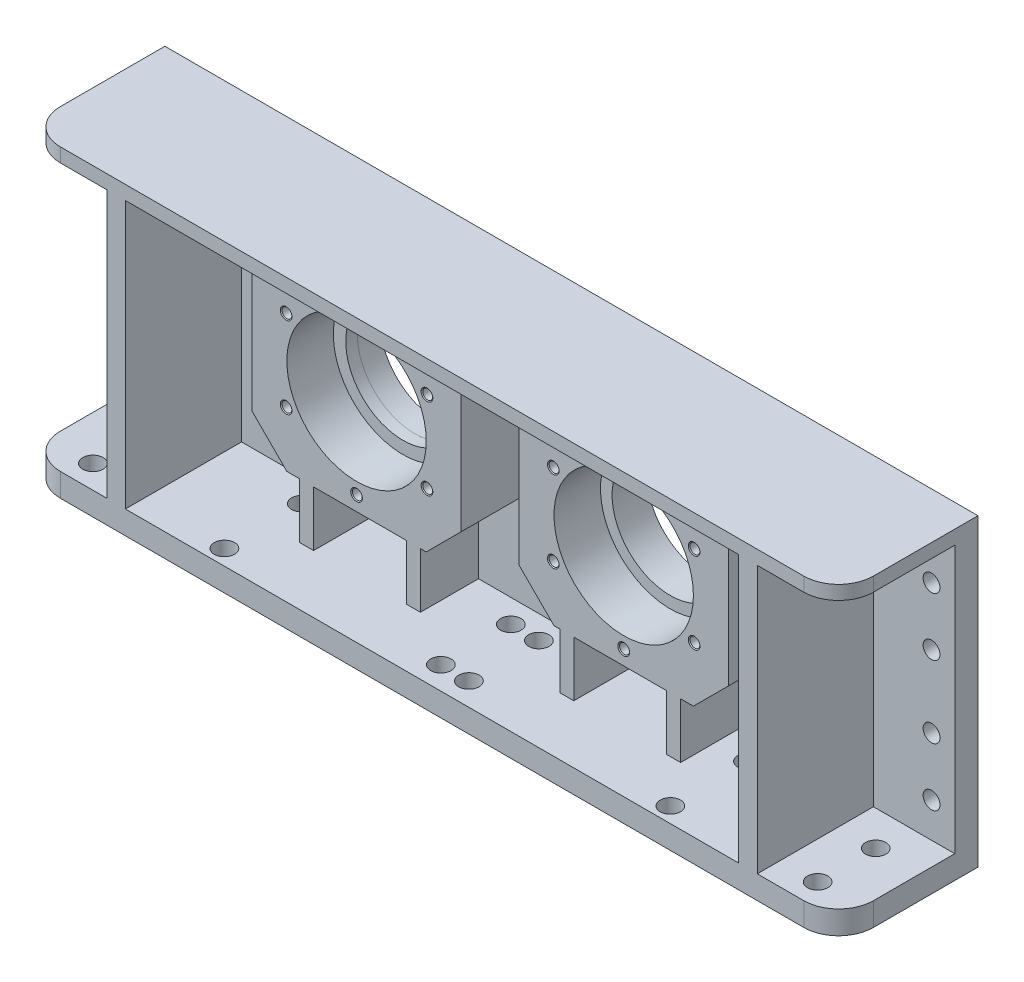
from build123d import *

# Parameters (mm, degrees)
SKETCH1_W           = 700
SKETCH1_H           = 120
BOSS_EXTRUDE1_DEPTH = 20
SKETCH2_W           = 700
SKETCH2_H           = 242
BOSS_EXTRUDE2_DEPTH = 20
BOSS_EXTRUDE3_DEPTH = 100
SKETCH4_R           = 50
CUT_EXTRUDE1_DEPTH  = 30
BOSS_EXTRUDE4_START = 50
SKETCH5_W           = 180
SKETCH5_H           = 165
SKETCH5_R           = 49.3285836
SKETCH5_R_2         = 50
BOSS_EXTRUDE4_DEPTH = 50
SKETCH7_R           = 60
CUT_EXTRUDE2_DEPTH  = 40
FILLET1_R           = 30
CHAMFER1_SIZE       = 30
SKETCH8_W           = 12
SKETCH8_H           = 50
BOSS_EXTRUDE5_DEPTH = 47.5
CIRPATTERN1_COUNT   = 6
SKETCH11_R          = 7.25
CUT_EXTRUDE3_DEPTH  = 40
SKETCH12_R          = 8.75
CUT_EXTRUDE4_DEPTH  = 40


with BuildPart() as part:
    # Sketch1 → Boss-Extrude1 (new body)
    with BuildSketch(Plane(origin=(0, 0, 0), x_dir=(1, 0, 0), z_dir=(0, 1, 0))):
        with Locations((0, -60)):
            Rectangle(SKETCH1_W, SKETCH1_H)
    extrude(amount=BOSS_EXTRUDE1_DEPTH)

    # Sketch2 → Boss-Extrude2 (add)
    with BuildSketch(Plane.XY):
        with Locations((0, 141)):
            Rectangle(SKETCH2_W, SKETCH2_H)
    extrude(amount=BOSS_EXTRUDE2_DEPTH)

    # Sketch3 → Boss-Extrude3 (add)
    with BuildSketch(Plane.XY.offset(20)):
        Polygon((350, 262), (-350, 262), (-350, 250), (-280, 250), (-280, 20), (-264, 20), (-264, 250), (264, 250), (264, 20), (280, 20), (280, 250), (350, 250), align=None)
    extrude(amount=BOSS_EXTRUDE3_DEPTH)

    # Sketch4 → Cut-Extrude1 (cut)
    with BuildSketch(Plane.XY.offset(20)):
        with Locations((-115, 150)):
            Circle(SKETCH4_R)
        with Locations((115, 150)):
            Circle(SKETCH4_R)
    extrude(amount=-CUT_EXTRUDE1_DEPTH, mode=Mode.SUBTRACT)

    # Sketch5 → Boss-Extrude4 (add)
    # profile 1 of 2: a face of its own
    with BuildSketch(Plane.XY.offset(20).offset(BOSS_EXTRUDE4_START)):
        with Locations((-115, 150)):
            Rectangle(SKETCH5_W, SKETCH5_H)
        with Locations((-115, 150)):
            Circle(SKETCH5_R, mode=Mode.SUBTRACT)
    # profile 2 of 2: a face of its own
    with BuildSketch(Plane.XY.offset(20).offset(BOSS_EXTRUDE4_START)):
        with Locations((115, 150)):
            Rectangle(SKETCH5_W, SKETCH5_H)
        with Locations((115, 150)):
            Circle(SKETCH5_R_2, mode=Mode.SUBTRACT)
    extrude(amount=-BOSS_EXTRUDE4_DEPTH)

    # Sketch7 → Cut-Extrude2 (cut)
    with BuildSketch(Plane.XY.offset(70)):
        with Locations((-115, 150)):
            Circle(SKETCH7_R)
        with Locations((115, 150)):
            Circle(SKETCH7_R)
    extrude(amount=-CUT_EXTRUDE2_DEPTH, mode=Mode.SUBTRACT)

    # Fillet1
    fillet1_edges = [part.edges().sort_by_distance(p)[0] for p in [
        (350, 256, 120),
        (-350, 256, 120),
        (350, 10, 120),
        (-350, 10, 120),
    ]]
    fillet(fillet1_edges, radius=FILLET1_R)

    # Chamfer1
    chamfer1_edges = [part.edges().sort_by_distance(p)[0] for p in [
        (-25, 67.5, 45),
        (-25, 232.5, 45),
        (-205, 232.5, 45),
        (-205, 67.5, 45),
        (205, 67.5, 45),
        (205, 232.5, 45),
        (25, 232.5, 45),
        (25, 67.5, 45),
    ]]
    chamfer(chamfer1_edges, length=CHAMFER1_SIZE)

    # Sketch8 → Boss-Extrude5 (add)
    with BuildSketch(Plane(origin=(0, 20, 0), x_dir=(1, 0, 0), z_dir=(0, 1, 0))):
        with Locations((-66, -45)):
            Rectangle(SKETCH8_W, SKETCH8_H)
        with Locations((66, -45)):
            Rectangle(SKETCH8_W, SKETCH8_H)
        with Locations((158, -45)):
            Rectangle(SKETCH8_W, SKETCH8_H)
        with Locations((-158, -45)):
            Rectangle(SKETCH8_W, SKETCH8_H)
    extrude(amount=BOSS_EXTRUDE5_DEPTH)

    # Sketch10 → M10 Tapped Hole1 (revolve, cut)
    with BuildSketch(Plane(origin=(-54.378221735, 185, 70), x_dir=(0, -1, 0), z_dir=(1, 0, 0))):
        Polygon((0, 0), (0, 30.053657631), (4.25, 27.5), (4.25, 0.650302214), (5.025, 0), align=None)
    m10_tapped_hole1 = revolve(axis=Axis((-54.378221735, 185, 76.35), (0, 0, -1)), mode=Mode.SUBTRACT)

    # CirPattern1: M10 Tapped Hole1 ×6 about axis
    cirpattern1_axis = Axis((-115, 150, 0), (0, 0, 1))
    for i in range(1, CIRPATTERN1_COUNT):
        add(m10_tapped_hole1.rotate(cirpattern1_axis, i * 360 / CIRPATTERN1_COUNT), mode=Mode.SUBTRACT)

    # Mirror1: M10 Tapped Hole1 across plane
    add(m10_tapped_hole1.mirror(Plane(origin=(0, 0, 0), x_dir=(0, 0, 1), z_dir=(1, 0, 0))), mode=Mode.SUBTRACT)

    # Mirror1 copy 1 sketch → Mirror1 copy 1 (revolve, cut)
    with BuildSketch(Plane(origin=(115, 220, 70), x_dir=(-0.8660254037844386, -0.5000000000000001, 0), z_dir=(-0.5000000000000001, 0.8660254037844386, 0))):
        Polygon((0, 0), (0, -30.053657631), (4.25, -27.5), (4.25, -0.650302214), (5.025, 0), align=None)
    revolve(axis=Axis((115, 220, 76.35), (0, 0, 1)), mode=Mode.SUBTRACT)

    # Mirror1 copy 2 sketch → Mirror1 copy 2 (revolve, cut)
    with BuildSketch(Plane(origin=(175.621778265, 185, 70), x_dir=(-0.8660254037844387, 0.4999999999999998, 0), z_dir=(0.4999999999999998, 0.8660254037844387, 0))):
        Polygon((0, 0), (0, -30.053657631), (4.25, -27.5), (4.25, -0.650302214), (5.025, 0), align=None)
    revolve(axis=Axis((175.621778265, 185, 76.35), (0, 0, 1)), mode=Mode.SUBTRACT)

    # Mirror1 copy 3 sketch → Mirror1 copy 3 (revolve, cut)
    with BuildSketch(Plane(origin=(175.621778265, 115, 70), x_dir=(0, 1, 0), z_dir=(1, 0, 0))):
        Polygon((0, 0), (0, -30.053657631), (4.25, -27.5), (4.25, -0.650302214), (5.025, 0), align=None)
    revolve(axis=Axis((175.621778265, 115, 76.35), (0, 0, 1)), mode=Mode.SUBTRACT)

    # Mirror1 copy 4 sketch → Mirror1 copy 4 (revolve, cut)
    with BuildSketch(Plane(origin=(115, 80, 70), x_dir=(0.8660254037844384, 0.5000000000000004, 0), z_dir=(0.5000000000000004, -0.8660254037844384, 0))):
        Polygon((0, 0), (0, -30.053657631), (4.25, -27.5), (4.25, -0.650302214), (5.025, 0), align=None)
    revolve(axis=Axis((115, 80, 76.35), (0, 0, 1)), mode=Mode.SUBTRACT)

    # Mirror1 copy 5 sketch → Mirror1 copy 5 (revolve, cut)
    with BuildSketch(Plane(origin=(54.378221735, 115, 70), x_dir=(0.8660254037844386, -0.5000000000000001, 0), z_dir=(-0.5000000000000001, -0.8660254037844386, 0))):
        Polygon((0, 0), (0, -30.053657631), (4.25, -27.5), (4.25, -0.650302214), (5.025, 0), align=None)
    revolve(axis=Axis((54.378221735, 115, 76.35), (0, 0, 1)), mode=Mode.SUBTRACT)

    # Sketch11 → Cut-Extrude3 (cut)
    with BuildSketch(Plane.XY.offset(20)):
        with Locations((330, 212)):
            Circle(SKETCH11_R)
        with Locations((330, 162)):
            Circle(SKETCH11_R)
        with Locations((330, 100)):
            Circle(SKETCH11_R)
        with Locations((330, 50)):
            Circle(SKETCH11_R)
    cut_extrude3 = extrude(amount=-CUT_EXTRUDE3_DEPTH, mode=Mode.SUBTRACT)

    # Sketch12 → Cut-Extrude4 (cut)
    with BuildSketch(Plane(origin=(0, 20, 0), x_dir=(1, 0, 0), z_dir=(0, 1, 0))):
        with Locations(Location((311.966460743, -50, 0), (0, 0, 270))):
            Circle(SKETCH12_R)
        with Locations(Location((311.966460743, -100, 0), (0, 0, 270))):
            Circle(SKETCH12_R)
        with Locations(Location((192.081589636, -40.105889272, 0), (0, 0, 270))):
            Circle(SKETCH12_R)
        with Locations(Location((191.966460743, -106.780261963, 0), (0, 0, 270))):
            Circle(SKETCH12_R)
        with Locations(Location((12.081589636, -40.105889272, 0), (0, 0, 270))):
            Circle(SKETCH12_R)
        with Locations(Location((12.081589636, -100.343403493, 0), (0, 0, 270))):
            Circle(SKETCH12_R)
    cut_extrude4 = extrude(amount=-CUT_EXTRUDE4_DEPTH, mode=Mode.SUBTRACT)

    # Mirror3: Cut-Extrude3, Cut-Extrude4 across plane
    add(cut_extrude3.mirror(Plane(origin=(0, 0, 0), x_dir=(0, 0, 1), z_dir=(1, 0, 0))), mode=Mode.SUBTRACT)
    add(cut_extrude4.mirror(Plane(origin=(0, 0, 0), x_dir=(0, 0, 1), z_dir=(1, 0, 0))), mode=Mode.SUBTRACT)


solid = part.part
